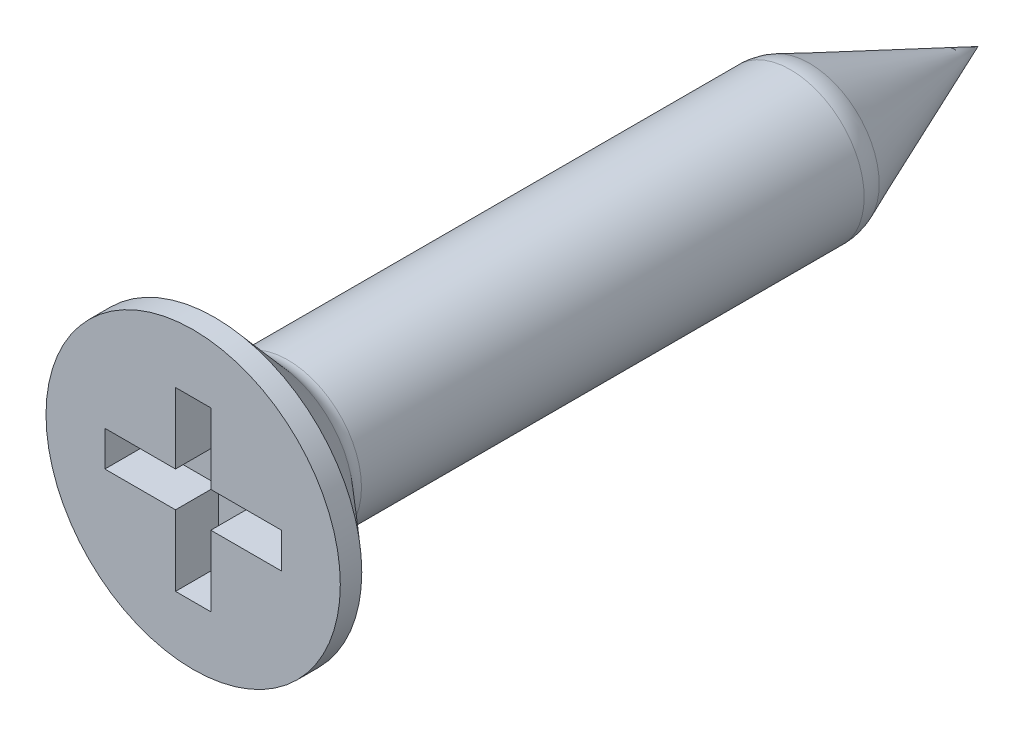
from build123d import *

# Parameters (mm, degrees)
CUT_EXTRUDE1_DEPTH = 0.875
FILLET1_R          = 0.4
FILLET2_R          = 1


with BuildPart() as part:
    # Sketch1 → Revolve1 (revolve)
    with BuildSketch(Plane(origin=(0, 0, 0), x_dir=(0, 0, -1), z_dir=(1, 0, 0)), mode=Mode.PRIVATE) as revolve1_sk:
        Polygon((-1.3125, 3), (0, 1.5), (10.628679656, 1.5), (14.25, 0), (-1.75, 0), (-1.75, 3), align=None)
    revolve(revolve1_sk.sketch.rotate(Axis((0, 0, 94.243212435), (0, 0, -1)), 90), axis=Axis((0, 0, 94.243212435), (0, 0, -1)))

    # Sketch5 → Cut-Extrude1 (cut)
    with BuildSketch(Plane.XY.offset(1.75)):
        Polygon((0, 1.8), (-0.36, 1.8), (-0.36, 0.36), (-1.8, 0.36), (-1.8, 0), (-1.8, -0.36), (-0.36, -0.36), (-0.36, -1.8), (0, -1.8), (0.36, -1.8), (0.36, -0.36), (1.8, -0.36), (1.8, 0), (1.8, 0.36), (0.36, 0.36), (0.36, 1.8), align=None)
    extrude(amount=-CUT_EXTRUDE1_DEPTH, mode=Mode.SUBTRACT)

    # Fillet1
    fillet1_edges = [part.edges().sort_by_distance(p)[0] for p in [
        (-1.5, 0, 0),
    ]]
    fillet(fillet1_edges, radius=FILLET1_R)

    # Fillet2
    fillet2_edges = [part.edges().sort_by_distance(p)[0] for p in [
        (-1.5, 0, -10.628679656),
    ]]
    fillet(fillet2_edges, radius=FILLET2_R)


solid = part.part
